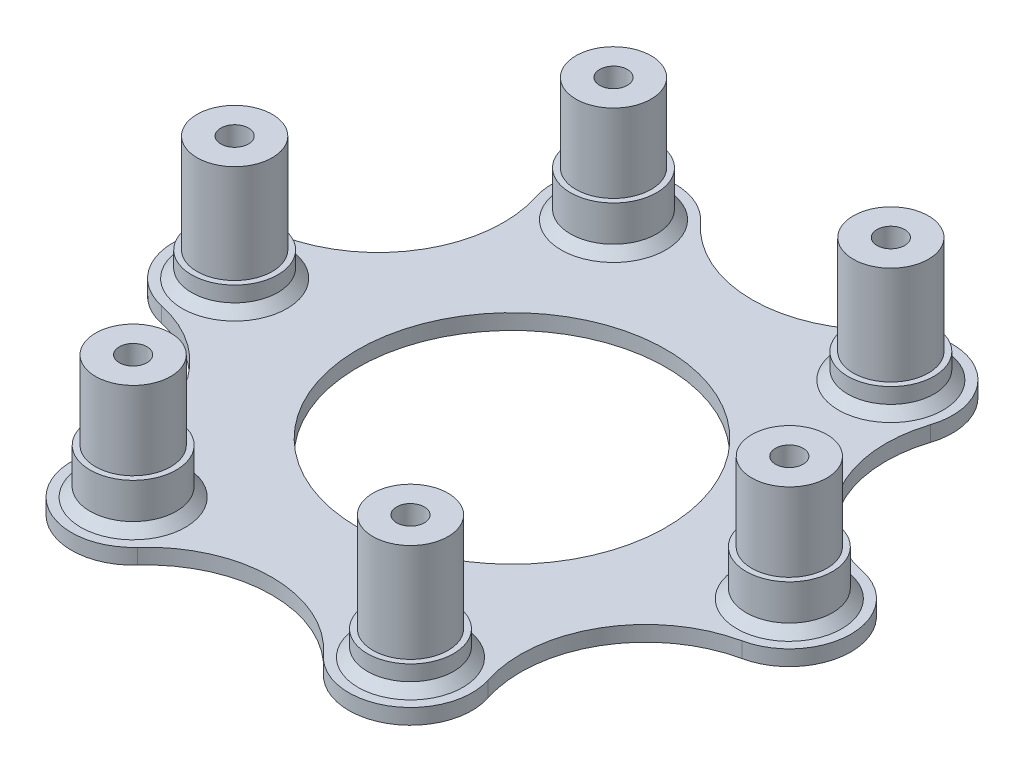
from build123d import *

# Parameters (mm, degrees)
EXTRUDE_1_DEPTH     = 2.5
SKETCH_3_R          = 7
EXTRUDE_2_DEPTH     = 4
CHAMFER_1_SIZE      = 1.5
SKETCH_4_R          = 6.1
EXTRUDE_3_DEPTH     = 16
SKETCH_5_R          = 7
EXTRUDE_4_DEPTH     = 3.3
SKETCH_6_R          = 2.25
CUT_EXTRUDE_1_DEPTH = 78.002745817
SKETCH_7_R          = 4
CUT_EXTRUDE_2_DEPTH = 4.5
SKETCH_8_R          = 25
CUT_EXTRUDE_3_DEPTH = 10


with BuildPart() as part:
    # 草图2 → 凸台-拉伸1 (new body)
    with BuildSketch(Plane(origin=(0, 0, 0), x_dir=(1, 0, 0), z_dir=(0, 1, 0))):
        with BuildLine():
            ThreePointArc((-47.091925455, 9.778744699), (-55, -1.253e-06), (-47.091923006, -9.778745223))
            ThreePointArc((-47.091923006, -9.778745223), (-33.750000065, -19.485571473), (-32.014603203, -35.893428778))
            ThreePointArc((-32.014603203, -35.893428778), (-27.500000081, -47.631397162), (-15.077319674, -45.672174193))
            ThreePointArc((-15.077319674, -45.672174193), (-9.8e-08, -38.97114317), (15.077319542, -45.672174048))
            ThreePointArc((15.077319542, -45.672174048), (27.500000118, -47.63139714), (32.014603117, -35.893428511))
            ThreePointArc((32.014603117, -35.893428511), (33.750000078, -19.485571451), (47.091922781, -9.778745271))
            ThreePointArc((47.091922781, -9.778745271), (55, -2.05e-07), (47.091923183, 9.778745185))
            ThreePointArc((47.091923183, 9.778745185), (33.750000105, 19.485571404), (32.01460321, 35.893428798))
            ThreePointArc((32.01460321, 35.893428798), (27.499999984, 47.631397217), (15.077319539, 45.672174044))
            ThreePointArc((15.077319539, 45.672174044), (1.8e-08, 38.97114317), (-15.077319515, 45.672174018))
            ThreePointArc((-15.077319515, 45.672174018), (-27.5000001, 47.63139715), (-32.014603117, 35.893428511))
            ThreePointArc((-32.014603117, 35.893428511), (-33.750000761, 19.485570266), (-47.091925455, 9.778744699))
        make_face()
    extrude(amount=EXTRUDE_1_DEPTH)

    # 草图3 → 凸台-拉伸2 (add)
    with BuildSketch(Plane(origin=(0, 2.5, 0), x_dir=(1, 0, 0), z_dir=(0, 1, 0))):
        with Locations(Location((-22.5, 38.97114317, 0), (0, 0, 270))):
            Circle(SKETCH_3_R)
        with Locations(Location((22.5, 38.97114317, 0), (0, 0, 270))):
            Circle(SKETCH_3_R)
        with Locations(Location((45, 0, 0), (0, 0, 270))):
            Circle(SKETCH_3_R)
        with Locations(Location((22.5, -38.97114317, 0), (0, 0, 270))):
            Circle(SKETCH_3_R)
        with Locations(Location((-22.5, -38.97114317, 0), (0, 0, 270))):
            Circle(SKETCH_3_R)
        with Locations(Location((-45, 0, 0), (0, 0, 270))):
            Circle(SKETCH_3_R)
    extrude(amount=EXTRUDE_2_DEPTH)

    # 倒角1
    chamfer_1_edges = [part.edges().sort_by_distance(p)[0] for p in [
        (-22.5, 2.5, -45.97114317),
        (22.5, 2.5, -45.97114317),
        (45, 2.5, -7),
        (22.5, 2.5, 31.97114317),
        (-22.5, 2.5, 31.97114317),
        (-45, 2.5, -7),
    ]]
    chamfer(chamfer_1_edges, length=CHAMFER_1_SIZE)

    # 草图4 → 凸台-拉伸3 (add)
    with BuildSketch(Plane(origin=(0, 6.5, 0), x_dir=(1, 0, 0), z_dir=(0, 1, 0))):
        with Locations(Location((-22.5, 38.97114317, 0), (0, 0, 270))):
            Circle(SKETCH_4_R)
        with Locations(Location((22.5, 38.97114317, 0), (0, 0, 270))):
            Circle(SKETCH_4_R)
        with Locations(Location((45, 0, 0), (0, 0, 270))):
            Circle(SKETCH_4_R)
        with Locations(Location((22.5, -38.97114317, 0), (0, 0, 270))):
            Circle(SKETCH_4_R)
        with Locations(Location((-22.5, -38.97114317, 0), (0, 0, 270))):
            Circle(SKETCH_4_R)
        with Locations(Location((-45, 0, 0), (0, 0, 270))):
            Circle(SKETCH_4_R)
    extrude(amount=EXTRUDE_3_DEPTH)

    # 草图5 → 凸台-拉伸4 (add)
    with BuildSketch(Plane(origin=(0, 6.5, 0), x_dir=(1, 0, 0), z_dir=(0, 1, 0))):
        with Locations(Location((-22.5, 38.97114317, 0), (0, 0, 270))):
            Circle(SKETCH_5_R)
        with Locations(Location((45, 0, 0), (0, 0, 270))):
            Circle(SKETCH_5_R)
        with Locations(Location((-22.5, -38.97114317, 0), (0, 0, 270))):
            Circle(SKETCH_5_R)
    extrude(amount=EXTRUDE_4_DEPTH)

    # 草图6 → 切除-拉伸1 (cut, through all)
    with BuildSketch(Plane.XZ):
        with Locations(Location((-22.5, 38.97114317, 0), (0, 0, 270))):
            Circle(SKETCH_6_R)
        with Locations(Location((22.5, 38.97114317, 0), (0, 0, 270))):
            Circle(SKETCH_6_R)
        with Locations(Location((45, 0, 0), (0, 0, 270))):
            Circle(SKETCH_6_R)
        with Locations(Location((22.5, -38.97114317, 0), (0, 0, 270))):
            Circle(SKETCH_6_R)
        with Locations(Location((-22.5, -38.97114317, 0), (0, 0, 270))):
            Circle(SKETCH_6_R)
        with Locations(Location((-45, 0, 0), (0, 0, 270))):
            Circle(SKETCH_6_R)
    extrude(amount=-CUT_EXTRUDE_1_DEPTH, mode=Mode.SUBTRACT)

    # 草图7 → 切除-拉伸2 (cut)
    with BuildSketch(Plane.XZ):
        with Locations(Location((-22.5, 38.97114317, 0), (0, 0, 270))):
            Circle(SKETCH_7_R)
        with Locations(Location((22.5, 38.97114317, 0), (0, 0, 270))):
            Circle(SKETCH_7_R)
        with Locations(Location((45, 0, 0), (0, 0, 270))):
            Circle(SKETCH_7_R)
        with Locations(Location((22.5, -38.97114317, 0), (0, 0, 270))):
            Circle(SKETCH_7_R)
        with Locations(Location((-22.5, -38.97114317, 0), (0, 0, 270))):
            Circle(SKETCH_7_R)
        with Locations(Location((-45, 0, 0), (0, 0, 270))):
            Circle(SKETCH_7_R)
    extrude(amount=-CUT_EXTRUDE_2_DEPTH, mode=Mode.SUBTRACT)

    # 草图8 → 切除-拉伸3 (cut)
    with BuildSketch(Plane(origin=(0, 2.5, 0), x_dir=(1, 0, 0), z_dir=(0, 1, 0))):
        with Locations(Location((0, 0, 0), (0, 0, 270))):
            Circle(SKETCH_8_R)
    extrude(amount=-CUT_EXTRUDE_3_DEPTH, mode=Mode.SUBTRACT)


solid = part.part
